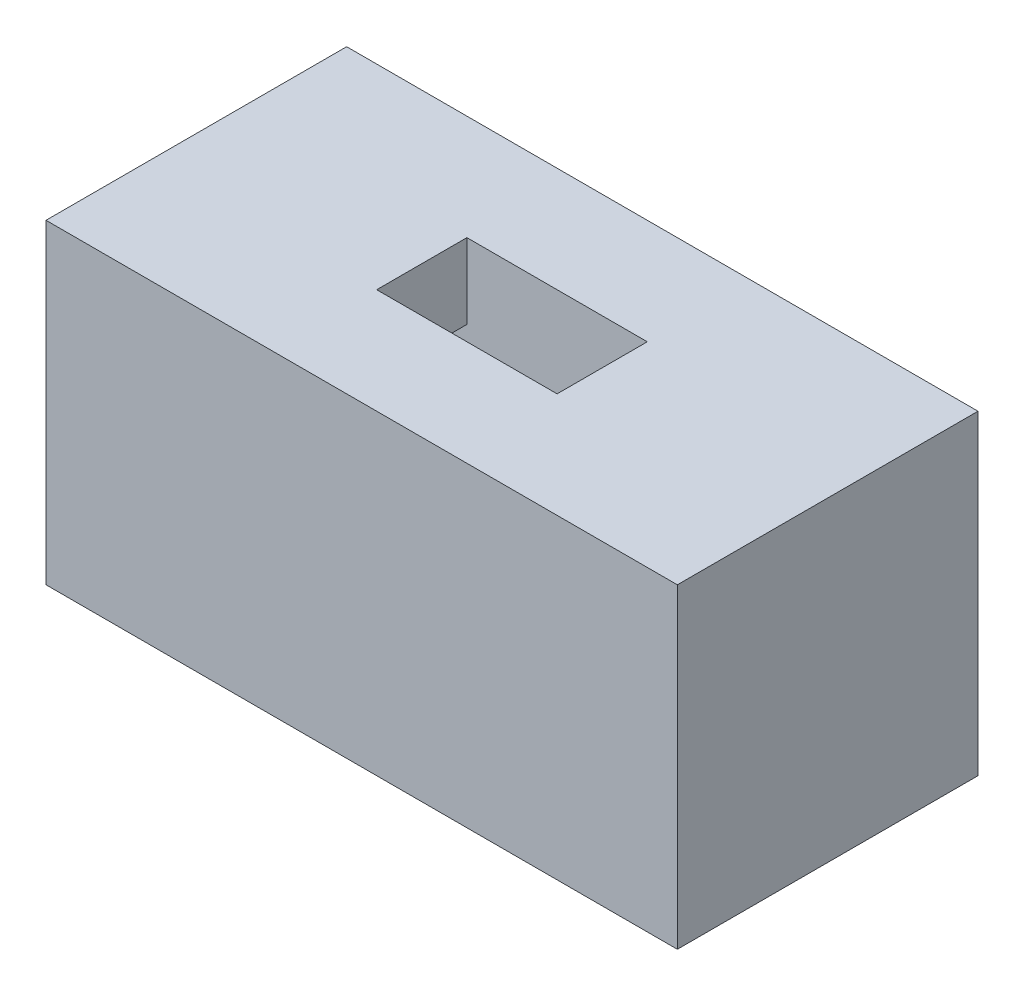
from build123d import *

# Parameters (mm, degrees)
ESQUISSE1_W             = 42
ESQUISSE1_H             = 20
BOSS_EXTRU_1_DEPTH      = 21
ESQUISSE2_W             = 12
ESQUISSE2_H             = 6
ENL_V_MAT_EXTRU_1_DEPTH = 10
ESQUISSE3_W             = 6
ESQUISSE3_H             = 5
ENL_V_MAT_EXTRU_2_DEPTH = 36.637059362


with BuildPart() as part:
    # Esquisse1 → Boss.-Extru.1 (new body)
    with BuildSketch(Plane(origin=(0, 0, 0), x_dir=(1, 0, 0), z_dir=(0, 1, 0))):
        Rectangle(ESQUISSE1_W, ESQUISSE1_H)
    extrude(amount=BOSS_EXTRU_1_DEPTH)

    # Esquisse2 → Enlèv. mat.-Extru.1 (cut)
    with BuildSketch(Plane(origin=(0, 21, 0), x_dir=(1, 0, 0), z_dir=(0, 1, 0))):
        Rectangle(ESQUISSE2_W, ESQUISSE2_H)
    extrude(amount=-ENL_V_MAT_EXTRU_1_DEPTH, mode=Mode.SUBTRACT)

    # Esquisse3 → Enlèv. mat.-Extru.2 (cut, through all)
    with BuildSketch(Plane(origin=(-6, 0, 0), x_dir=(0, 0, -1), z_dir=(1, 0, 0))):
        with Locations((0, 13.5)):
            Rectangle(ESQUISSE3_W, ESQUISSE3_H)
    extrude(amount=-ENL_V_MAT_EXTRU_2_DEPTH, mode=Mode.SUBTRACT)


solid = part.part
